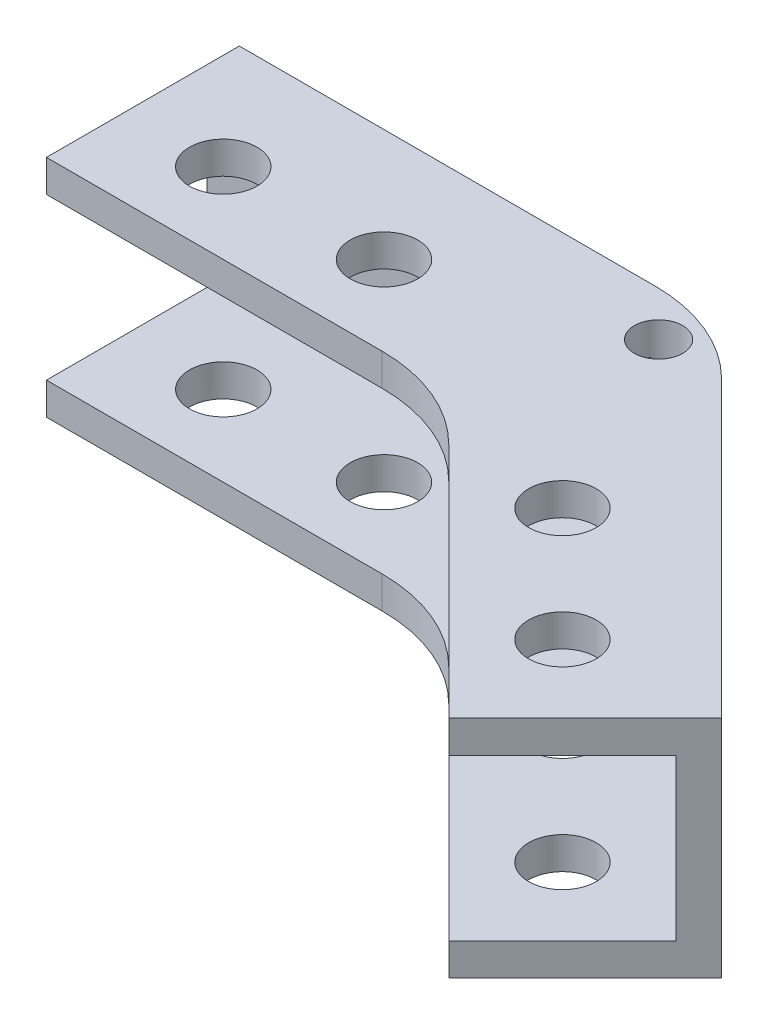
from build123d import *

# Parameters (mm, degrees)
BOSS_EXTRUDE1_DEPTH = 14
BOSS_EXTRUDE2_DEPTH = 2
BOSS_EXTRUDE3_DEPTH = 2
SKETCH4_R           = 2.1
CUT_EXTRUDE1_DEPTH  = 15
SKETCH5_R           = 1.5
CUT_EXTRUDE2_DEPTH  = 15
SKETCH6_W           = 7
SKETCH6_H           = 6
CUT_EXTRUDE3_DEPTH  = 15
SKETCH7_W           = 7
SKETCH7_H           = 6
CUT_EXTRUDE4_DEPTH  = 15
FILLET2_R           = 10
FILLET3_R           = 10


with BuildPart() as part:
    # Sketch1 → Boss-Extrude1 (new body)
    with BuildSketch(Plane(origin=(0, 0, 0), x_dir=(1, 0, 0), z_dir=(0, 1, 0))):
        Polygon((-27.184182145, 10), (2.815817855, 10), (24.029021291, -11.213203436), (22.614807728, -12.627416998), (1.98739073, 8), (-27.184182145, 8), align=None)
    extrude(amount=BOSS_EXTRUDE1_DEPTH)

    # Sketch2 → Boss-Extrude2 (add)
    with BuildSketch(Plane(origin=(0, 14, 0), x_dir=(1, 0, 0), z_dir=(0, 1, 0))):
        Polygon((-27.184182145, 8), (-27.184182145, -2), (-2.154744893, -2), (15.543739917, -19.69848481), (22.614807728, -12.627416998), (1.98739073, 8), align=None)
    extrude(amount=-BOSS_EXTRUDE2_DEPTH)

    # Sketch3 → Boss-Extrude3 (add)
    with BuildSketch(Plane.XZ):
        Polygon((-27.184182145, -8), (-27.184182145, 2), (-2.154744893, 2), (15.543739917, 19.69848481), (22.614807728, 12.627416998), (1.98739073, -8), align=None)
    extrude(amount=-BOSS_EXTRUDE3_DEPTH)

    # Sketch4 → Cut-Extrude1 (cut)
    with BuildSketch(Plane(origin=(0, 14, 0), x_dir=(1, 0, 0), z_dir=(0, 1, 0))):
        with Locations(Location((-21.184182145, 3, 0), (0, 0, 270))):
            Circle(SKETCH4_R)
        with Locations(Location((-11.184182145, 3, 0), (0, 0, 270))):
            Circle(SKETCH4_R)
        with Locations(Location((7.765565323, -4.849242405, 0), (0, 0, 270))):
            Circle(SKETCH4_R)
        with Locations(Location((14.836633135, -11.920310217, 0), (0, 0, 270))):
            Circle(SKETCH4_R)
    extrude(amount=-CUT_EXTRUDE1_DEPTH, mode=Mode.SUBTRACT)

    # Sketch5 → Cut-Extrude2 (cut)
    with BuildSketch(Plane(origin=(0, 14, 0), x_dir=(1, 0, 0), z_dir=(0, 1, 0))):
        with Locations(Location((1.667767558, 7.228361402, 0), (0, 0, 270))):
            Circle(SKETCH5_R)
    extrude(amount=-CUT_EXTRUDE2_DEPTH, mode=Mode.SUBTRACT)

    # Sketch6 → Cut-Extrude3 (cut)
    with BuildSketch(Plane(origin=(0, 0, -10), x_dir=(-1, 0, 0), z_dir=(0, 0, -1))):
        with Locations((0.684182145, 7)):
            Rectangle(SKETCH6_W, SKETCH6_H)
    extrude(amount=-CUT_EXTRUDE3_DEPTH, mode=Mode.SUBTRACT)

    # Sketch7 → Cut-Extrude4 (cut)
    with BuildSketch(Plane(origin=(6.407908928, 0, -6.407908928), x_dir=(-0.7071067811865465, 0, -0.7071067811865487), z_dir=(0.7071067811865487, 0, -0.7071067811865465))):
        with Locations((1.579983912, 7)):
            Rectangle(SKETCH7_W, SKETCH7_H)
    extrude(amount=-CUT_EXTRUDE4_DEPTH, mode=Mode.SUBTRACT)

    # Fillet2
    fillet2_edges = [part.edges().sort_by_distance(p)[0] for p in [
        (2.815817855, 2, -10),
        (2.815817855, 12, -10),
    ]]
    fillet(fillet2_edges, radius=FILLET2_R)

    # Fillet3
    fillet3_edges = [part.edges().sort_by_distance(p)[0] for p in [
        (-2.154744893, 13, 2),
        (-2.154744893, 1, 2),
    ]]
    fillet(fillet3_edges, radius=FILLET3_R)


solid = part.part
